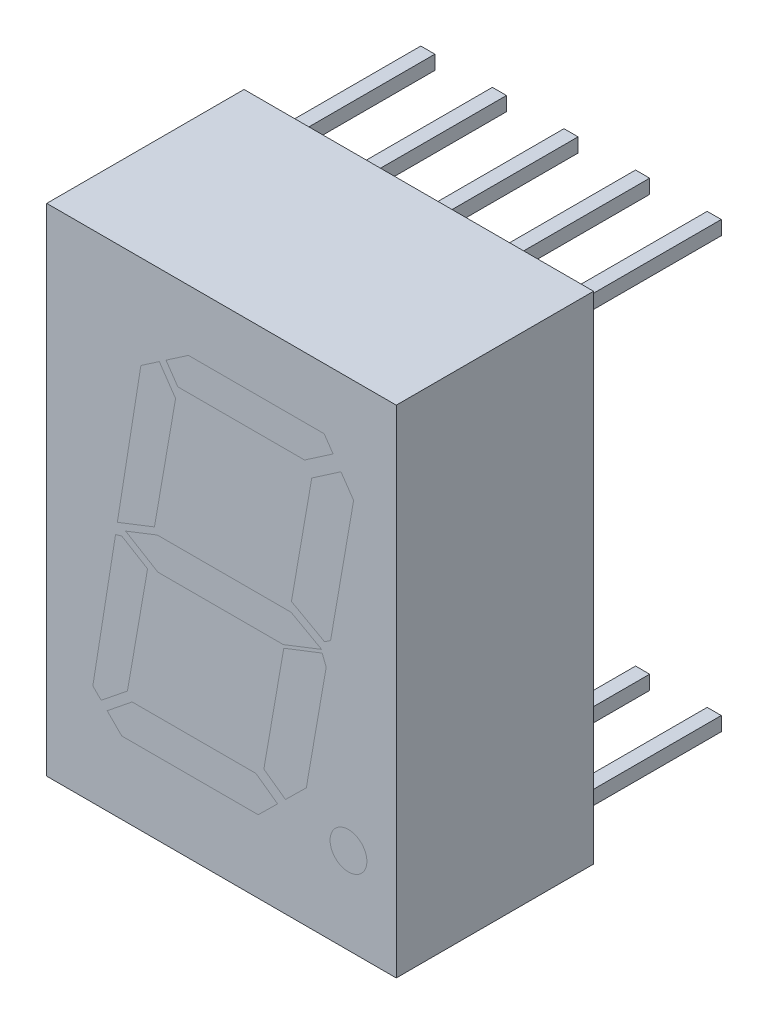
from build123d import *

# Parameters (mm, degrees)
ESQUISSE1_W                    = 12.4
ESQUISSE1_H                    = 17.6
BOSS_EXTRU_1_DEPTH             = 7
ESQUISSE2_W                    = 0.5
ESQUISSE2_H                    = 0.5
BOSS_EXTRU_2_DEPTH             = 5.4
R_P_TITION_LIN_AIRE1_COUNT     = 3
R_P_TITION_LIN_AIRE1_PITCH     = 2.54
R_P_TITION_LIN_AIRE1_COL_COUNT = 3
R_P_TITION_LIN_AIRE1_COL_PITCH = 2.54


with BuildPart() as part:
    # Esquisse1 → Boss.-Extru.1 (new body)
    with BuildSketch(Plane.XY):
        with Locations((6.2, 8.8)):
            Rectangle(ESQUISSE1_W, ESQUISSE1_H)
    extrude(amount=BOSS_EXTRU_1_DEPTH)

    # Esquisse2 → Boss.-Extru.2 (add)
    with BuildSketch(Plane(origin=(0, 0, 0), x_dir=(-1, 0, 0), z_dir=(0, 0, -1))):
        with Locations((-6.2, 1.18)):
            Rectangle(ESQUISSE2_W, ESQUISSE2_H)
        with Locations((-6.2, 16.42)):
            Rectangle(ESQUISSE2_W, ESQUISSE2_H)
    boss_extru_2 = extrude(amount=BOSS_EXTRU_2_DEPTH)

    # Répétition linéaire1: Boss.-Extru.2 ×3
    with Locations(*[(i * R_P_TITION_LIN_AIRE1_PITCH, 0, 0) for i in range(1, R_P_TITION_LIN_AIRE1_COUNT)]):
        add(boss_extru_2)

    # Répétition linéaire1 col: Boss.-Extru.2 ×3
    with Locations(*[(-i * R_P_TITION_LIN_AIRE1_COL_PITCH, 0, 0) for i in range(1, R_P_TITION_LIN_AIRE1_COL_COUNT)]):
        add(boss_extru_2)


solid = part.part
